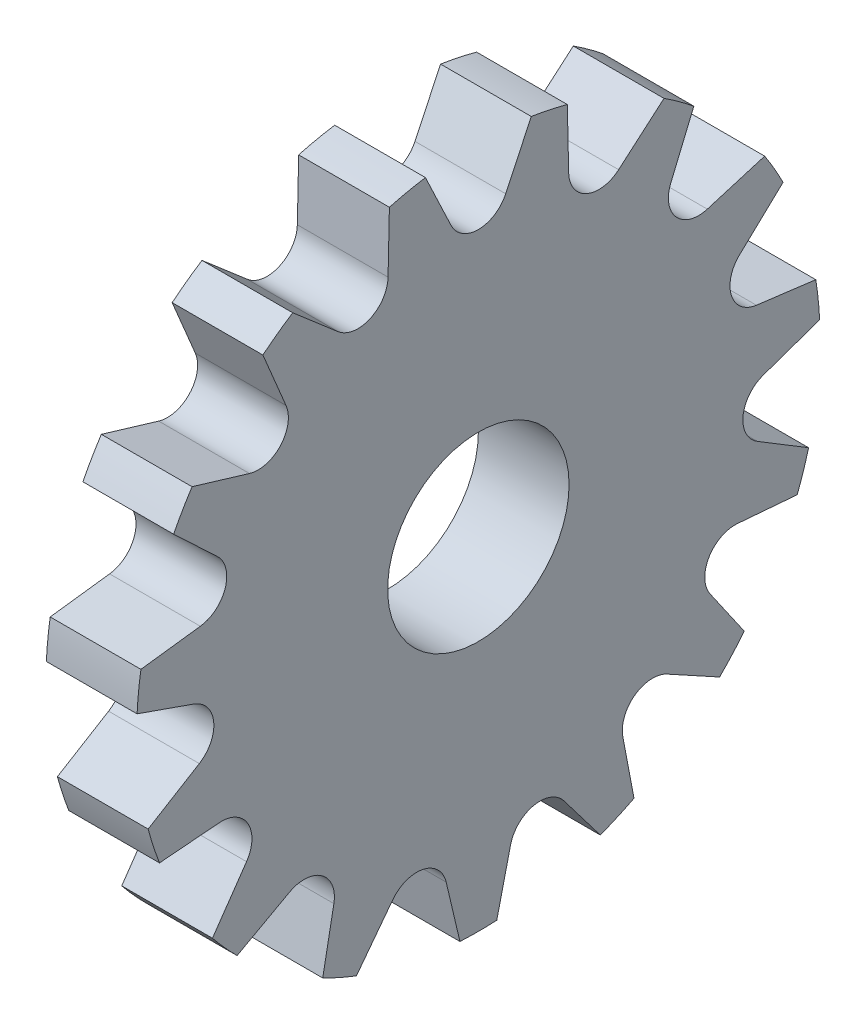
from build123d import *

# Parameters (mm, degrees)
SKETCH1_R           = 22.6
SKETCH1_R_2         = 6
BOSS_EXTRUDE1_DEPTH = 6
CUT_EXTRUDE1_DEPTH  = 6
CIRPATTERN1_COUNT   = 15


with BuildPart() as part:
    # Sketch1 → Boss-Extrude1 (new body)
    with BuildSketch(Plane(origin=(0, 0, 0), x_dir=(0, 0, -1), z_dir=(1, 0, 0))):
        Circle(SKETCH1_R)
        Circle(SKETCH1_R_2, mode=Mode.SUBTRACT)
    extrude(amount=BOSS_EXTRUDE1_DEPTH)

    # Sketch2 → Cut-Extrude1 (cut)
    with BuildSketch(Plane(origin=(6, 0, 0), x_dir=(0, 0, -1), z_dir=(1, 0, 0))):
        with BuildLine():
            Line((-3.5, 22.327337504), (-1.808436926, 18.745859565))
            ThreePointArc((-1.808436926, 18.745859565), (0, 17.6), (1.808436926, 18.745859565))
            Line((1.808436926, 18.745859565), (3.5, 22.327337504))
            Line((3.5, 22.327337504), (0, 25.827337504))
            Line((0, 25.827337504), (-3.5, 22.327337504))
        make_face()
    cut_extrude1 = extrude(amount=-CUT_EXTRUDE1_DEPTH, mode=Mode.SUBTRACT)

    # CirPattern1: Cut-Extrude1 ×15 about axis
    cirpattern1_axis = Axis((0, 0, 0), (1, 0, 0))
    for i in range(1, CIRPATTERN1_COUNT):
        add(cut_extrude1.rotate(cirpattern1_axis, i * 360 / CIRPATTERN1_COUNT), mode=Mode.SUBTRACT)


solid = part.part
